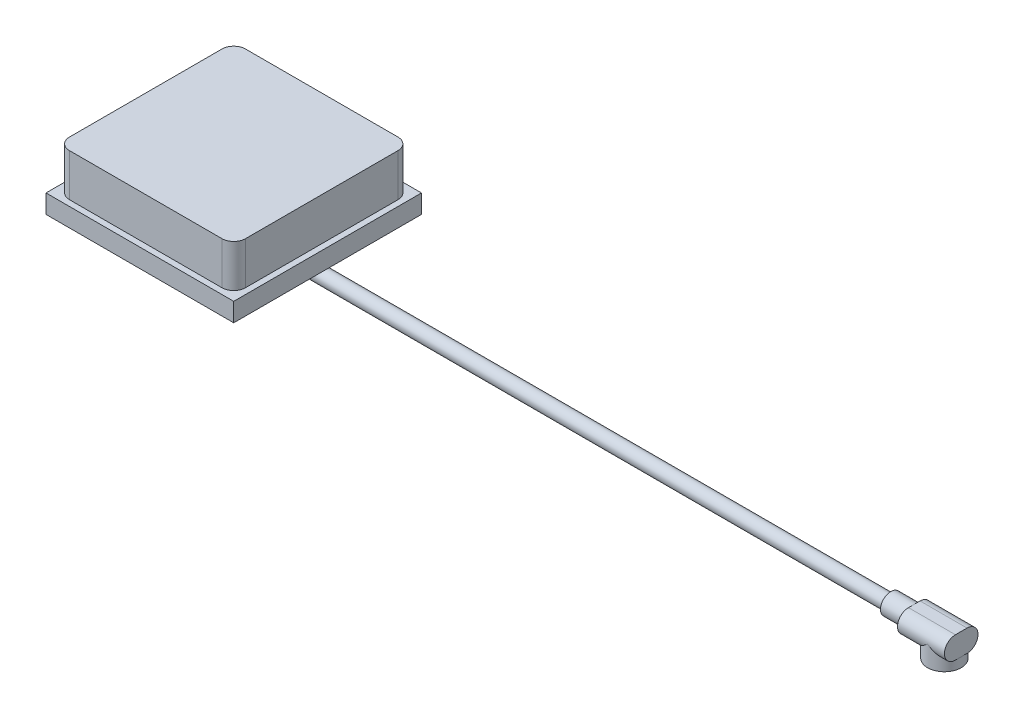
from build123d import *

# Parameters (mm, degrees)
SKETCH1_W           = 16
SKETCH1_H           = 16
BOSS_EXTRUDE1_DEPTH = 1.5875
BOSS_EXTRUDE2_DEPTH = 3.625
BOSS_EXTRUDE3_DEPTH = 1.5875
SKETCH5_R           = 0.599365756
BOSS_EXTRUDE6_DEPTH = 50
SKETCH6_R           = 0.881021891
BOSS_EXTRUDE7_DEPTH = 2
BOSS_EXTRUDE8_DEPTH = 4
SKETCH8_R           = 1.431086417
BOSS_EXTRUDE9_DEPTH = 1.75
SKETCH9_R           = 1.026782917
SKETCH9_R_2         = 0.386874667
CUT_EXTRUDE1_DEPTH  = 0.5


with BuildPart() as part:
    # Sketch1 → Boss-Extrude1 (new body)
    with BuildSketch(Plane(origin=(0, 0, 0), x_dir=(1, 0, 0), z_dir=(0, 1, 0))):
        Rectangle(SKETCH1_W, SKETCH1_H)
    extrude(amount=BOSS_EXTRUDE1_DEPTH)

    # Sketch2 → Boss-Extrude2 (add)
    with BuildSketch(Plane(origin=(0, 1.5875, 0), x_dir=(1, 0, 0), z_dir=(0, 1, 0))):
        with BuildLine():
            Line((-6.5, -7.5), (6.5, -7.5))
            ThreePointArc((6.5, -7.5), (7.207106781, -7.207106781), (7.5, -6.5))
            Line((7.5, -6.5), (7.5, 6.5))
            ThreePointArc((7.5, 6.5), (7.207106781, 7.207106781), (6.5, 7.5))
            Line((6.5, 7.5), (-6.5, 7.5))
            ThreePointArc((-6.5, 7.5), (-7.207106781, 7.207106781), (-7.5, 6.5))
            Line((-7.5, 6.5), (-7.5, -6.5))
            ThreePointArc((-7.5, -6.5), (-7.207106781, -7.207106781), (-6.5, -7.5))
        make_face()
    extrude(amount=BOSS_EXTRUDE2_DEPTH)

    # Sketch4 → Boss-Extrude3 (add)
    with BuildSketch(Plane.XZ):
        Polygon((5, 6), (-5, 6), (-6, 5), (-6, -5), (-5, -6), (5, -6), (6, -5), (6, 5), align=None)
    extrude(amount=BOSS_EXTRUDE3_DEPTH)

    # Sketch5 → Boss-Extrude6 (add)
    with BuildSketch(Plane(origin=(6, 0, 0), x_dir=(0, 0, -1), z_dir=(1, 0, 0))):
        with Locations(Location((0, -0.711731406, 0), (0, 0, 180))):
            Circle(SKETCH5_R)
    extrude(amount=BOSS_EXTRUDE6_DEPTH)

    # Sketch6 → Boss-Extrude7 (add)
    with BuildSketch(Plane(origin=(56, 0, 0), x_dir=(0, 0, -1), z_dir=(1, 0, 0))):
        with Locations((0, -0.711731406)):
            Circle(SKETCH6_R)
    extrude(amount=BOSS_EXTRUDE7_DEPTH)

    # Sketch7 → Boss-Extrude8 (add)
    with BuildSketch(Plane(origin=(58, 0, 0), x_dir=(0, 0, -1), z_dir=(1, 0, 0))):
        with BuildLine():
            Line((-0.493950471, 0.22540454), (0.493950471, 0.22540454))
            ThreePointArc((0.493950471, 0.22540454), (1.431086417, -0.711731406), (0.493950471, -1.648867351))
            Line((0.493950471, -1.648867351), (-0.493950471, -1.648867351))
            ThreePointArc((-0.493950471, -1.648867351), (-1.431086417, -0.711731406), (-0.493950471, 0.22540454))
        make_face()
    extrude(amount=BOSS_EXTRUDE8_DEPTH)

    # Sketch8 → Boss-Extrude9 (add)
    with BuildSketch(Plane.XZ.offset(0.711731406)):
        with Locations(Location((60.568913583, 0, 0), (0, 0, 270))):
            Circle(SKETCH8_R)
    extrude(amount=BOSS_EXTRUDE9_DEPTH)

    # Sketch9 → Cut-Extrude1 (cut)
    with BuildSketch(Plane(origin=(0, -2.461731406, 0), x_dir=(-1, 0, 0), z_dir=(0, -1, 0))):
        with Locations(Location((-60.568913583, 0, 0), (0, 0, 90))):
            Circle(SKETCH9_R)
        with Locations(Location((-60.568913583, 0, 0), (0, 0, 90))):
            Circle(SKETCH9_R_2, mode=Mode.SUBTRACT)
    extrude(amount=-CUT_EXTRUDE1_DEPTH, mode=Mode.SUBTRACT)


solid = part.part
